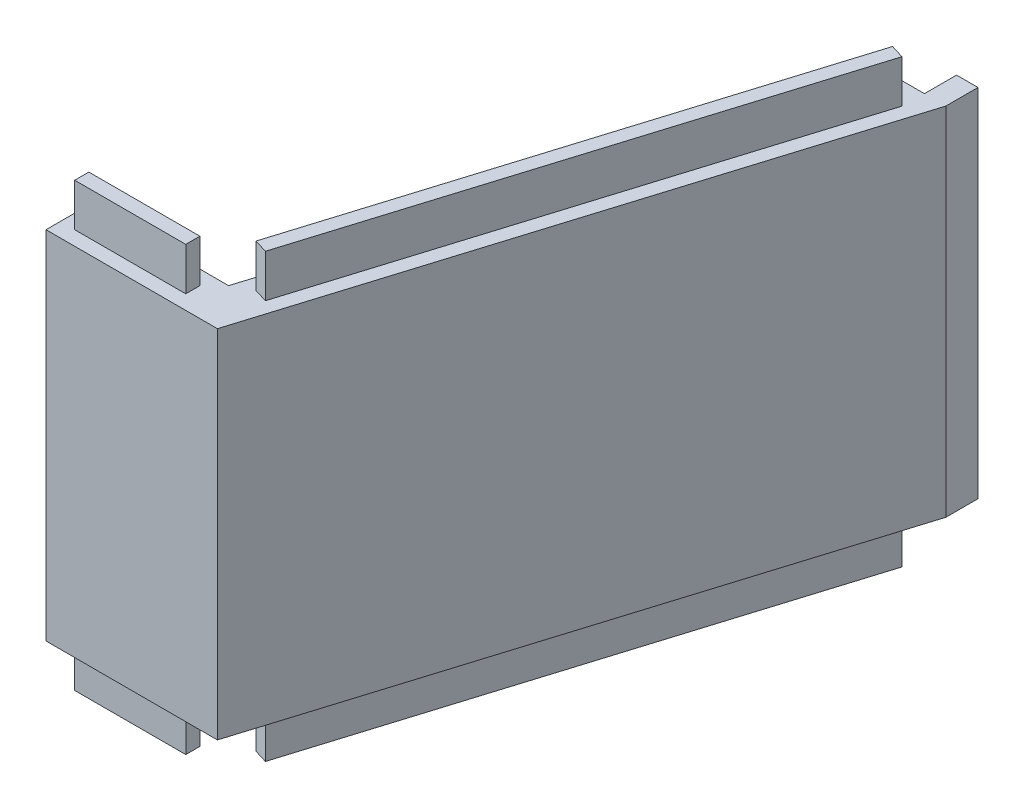
from build123d import *

# Parameters (mm, degrees)
BOSS_EXTRUDE1_DEPTH = 83.125
SKETCH2_W           = 25.914253455
SKETCH2_H           = 3.3
BOSS_EXTRUDE2_DEPTH = 10


with BuildPart() as part:
    # Sketch1 → Boss-Extrude1 (new body)
    with BuildSketch(Plane(origin=(0, 0, 0), x_dir=(-1, 0, 0), z_dir=(0, 1, 0))):
        Polygon((69.688093764, 147.570616058), (29.688093764, 147.570616058), (39.245883851, 144.62975757), (37.073840309, 137.570616058), (69.688093764, 137.570616058), align=None)
        Polygon((39.245883851, 144.62975757), (29.688093764, 147.570616058), (29.688093764, 137.570616058), (37.073840309, 137.570616058), align=None)
        Polygon((29.688093764, 147.570616058), (-10.311906236, 17.570616058), (-5.311906236, 17.570616058), (0.150763386, 17.570616058), (37.073840309, 137.570616058), (29.688093764, 137.570616058), align=None)
        Polygon((-5.311906236, 16.03215452), (-10.311906236, 17.570616058), (-10.311906236, 10.070616058), (-5.311906236, 10.070616058), align=None)
        Polygon((-5.311906236, 17.570616058), (-10.311906236, 17.570616058), (-5.311906236, 16.03215452), align=None)
    extrude(amount=BOSS_EXTRUDE1_DEPTH)

    # Sketch2 → Boss-Extrude2 (add)
    with BuildSketch(Plane(origin=(0, 83.125, 0), x_dir=(-1, 0, 0), z_dir=(0, 1, 0))):
        Polygon((32.886793036, 135.353943973), (-2.0659087, 21.757663331), (-5.219979428, 22.728146632), (29.732722307, 136.324427274), align=None)
        with Locations((53.380967037, 142.570616058)):
            Rectangle(SKETCH2_W, SKETCH2_H)
    boss_extrude2 = extrude(amount=BOSS_EXTRUDE2_DEPTH)

    # Mirror1: Boss-Extrude2 across plane
    add(boss_extrude2.mirror(Plane.ZX.offset(41.5625)))


solid = part.part
